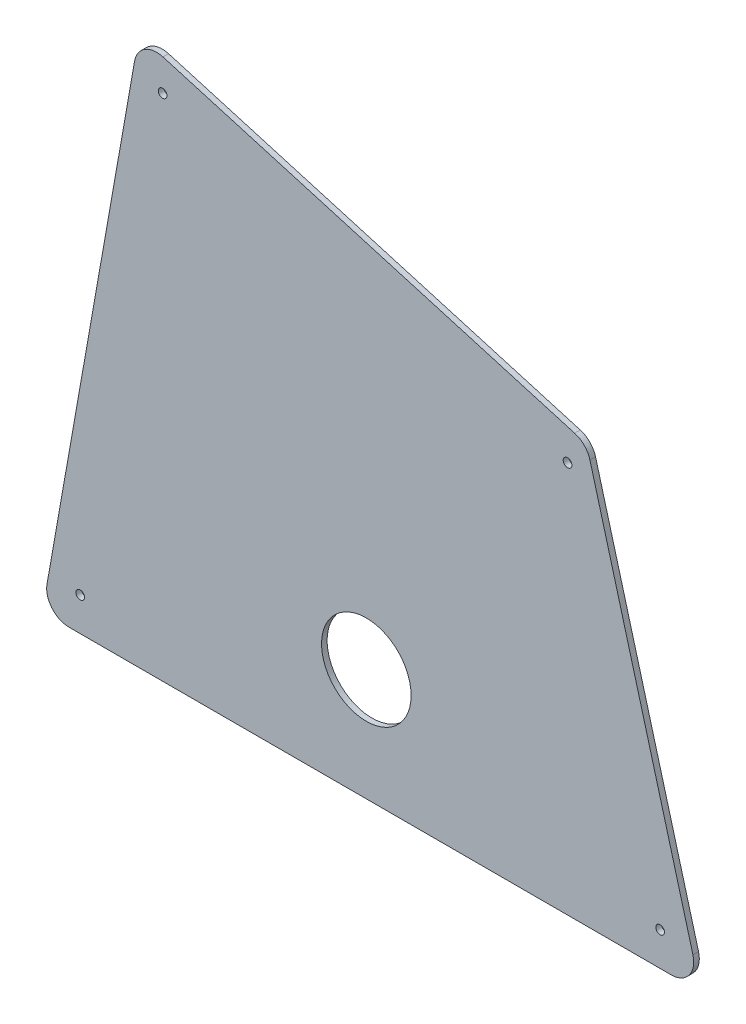
from build123d import *

# Parameters (mm, degrees)
SKETCH1_R                    = 25.4
BOSS_EXTRUDE1_DEPTH          = 3.175
F_10_0_1935_DIAMETER_HOLE1_D = 4.9149


with BuildPart() as part:
    # Sketch1 → Boss-Extrude1 (new body)
    with BuildSketch(Plane.XY):
        with BuildLine():
            Line((-115.39963726, 121.856862886), (118.175506769, 53.775916926))
            ThreePointArc((118.175506769, 53.775916926), (123.677628265, 50.487202579), (126.872726544, 44.930195291))
            Line((126.872726544, 44.930195291), (185.309252431, -168.971096981))
            ThreePointArc((185.309252431, -168.971096981), (183.152652559, -180.024636286), (173.058204177, -185.018008497))
            Line((173.058204177, -185.018008497), (-168.674542419, -185.018008497))
            ThreePointArc((-168.674542419, -185.018008497), (-178.403306847, -180.48141114), (-181.181600882, -170.112676641))
            Line((-181.181600882, -170.112676641), (-131.460524201, 111.869561592))
            ThreePointArc((-131.460524201, 111.869561592), (-125.659927441, 120.449097441), (-115.39963726, 121.856862886))
        make_face()
        with Locations((0, -121.518008497)):
            Circle(SKETCH1_R, mode=Mode.SUBTRACT)
    extrude(amount=BOSS_EXTRUDE1_DEPTH)

    # #10 (0.1935) Diameter Hole1 (through all)
    with Locations(Plane.XY.offset(3.175)):
        with Locations((-115.585524201, 103.906991503), (114.172726544, 37.231991503), (166.708204177, -165.968008497), (-162.324542419, -165.968008497)):
            Hole(F_10_0_1935_DIAMETER_HOLE1_D / 2)


solid = part.part
